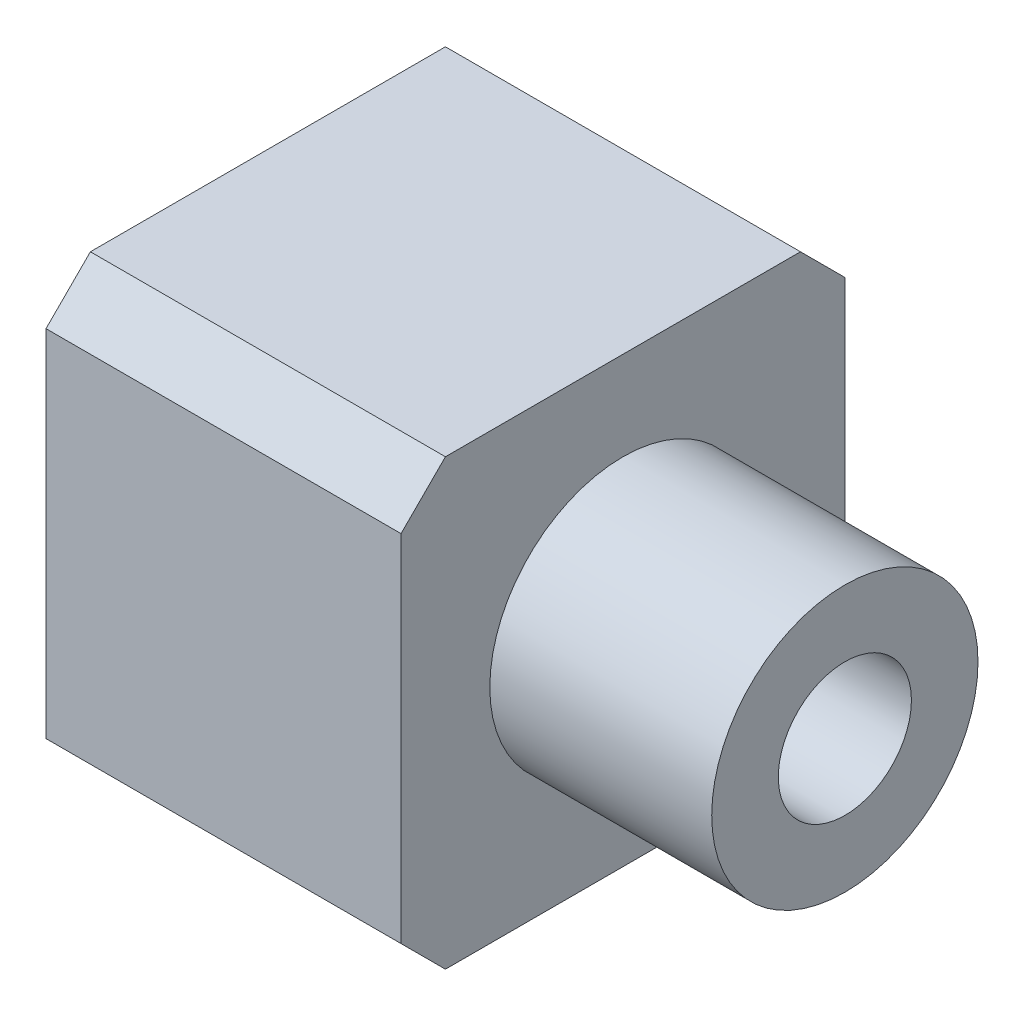
from build123d import *

# Parameters (mm, degrees)
SKETCH1_W           = 10
SKETCH1_H           = 10
BOSS_EXTRUDE1_DEPTH = 15
SKETCH2_R           = 15.353568197
SKETCH2_R_2         = 3
CUT_EXTRUDE1_DEPTH  = 5
CUT_EXTRUDE2_START  = -2
SKETCH3_R           = 15.635411304
SKETCH3_R_2         = 3
CUT_EXTRUDE2_DEPTH  = 2
SKETCH4_R           = 1.5
CUT_EXTRUDE3_DEPTH  = 17.583123952
CHAMFER1_SIZE       = 1
CUT_EXTRUDE4_START  = 5
SKETCH5_R           = 1.5
CUT_EXTRUDE4_DEPTH  = 2


with BuildPart() as part:
    # Sketch1 → Boss-Extrude1 (new body)
    with BuildSketch(Plane(origin=(0, 0, 0), x_dir=(0, 0, -1), z_dir=(1, 0, 0))):
        Rectangle(SKETCH1_W, SKETCH1_H)
    extrude(amount=-BOSS_EXTRUDE1_DEPTH)

    # Sketch2 → Cut-Extrude1 (cut)
    with BuildSketch(Plane(origin=(0, 0, 0), x_dir=(0, 0, -1), z_dir=(1, 0, 0))):
        Circle(SKETCH2_R)
        Circle(SKETCH2_R_2, mode=Mode.SUBTRACT)
    extrude(amount=-CUT_EXTRUDE1_DEPTH, mode=Mode.SUBTRACT)

    # Sketch3 → Cut-Extrude2 (cut)
    with BuildSketch(Plane.ZY.offset(15).offset(CUT_EXTRUDE2_START)):
        Circle(SKETCH3_R)
        with Locations(Location((0, 0, 0), (0, 0, 180))):
            Circle(SKETCH3_R_2, mode=Mode.SUBTRACT)
    extrude(amount=CUT_EXTRUDE2_DEPTH, mode=Mode.SUBTRACT)

    # Sketch4 → Cut-Extrude3 (cut, through all)
    with BuildSketch(Plane(origin=(0, 0, 0), x_dir=(0, 0, -1), z_dir=(1, 0, 0))):
        Circle(SKETCH4_R)
    extrude(amount=-CUT_EXTRUDE3_DEPTH, mode=Mode.SUBTRACT)

    # Chamfer1
    chamfer1_edges = [part.edges().sort_by_distance(p)[0] for p in [
        (-9, -5, -5),
        (-9, -5, 5),
        (-9, 5, -5),
        (-9, 5, 5),
    ]]
    chamfer(chamfer1_edges, length=CHAMFER1_SIZE)

    # Sketch5 → Cut-Extrude4 (cut)
    with BuildSketch(Plane(origin=(0, 0, 0), x_dir=(-1, 0, 0), z_dir=(0, 0, -1)).offset(CUT_EXTRUDE4_START)):
        with Locations((9, 0)):
            Circle(SKETCH5_R)
    extrude(amount=-CUT_EXTRUDE4_DEPTH, mode=Mode.SUBTRACT)


solid = part.part
